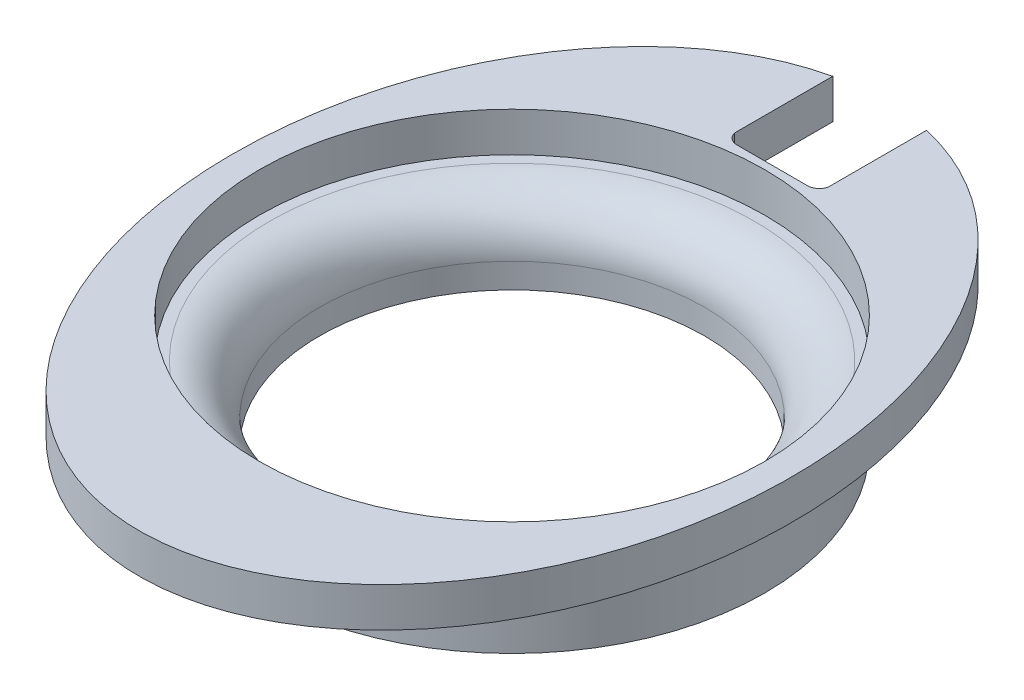
from build123d import *

# Parameters (mm, degrees)
SKETCH2_R           = 20.335
BOSS_EXTRUDE1_DEPTH = 3.175
SKETCH2_4_R         = 20.335
BOSS_EXTRUDE2_DEPTH = 6
SKETCH3_R           = 15.5
CUT_EXTRUDE1_DEPTH  = 6
FILLET2_R           = 4


with BuildPart() as part:
    # Sketch2 → Boss-Extrude1 (new body)
    with BuildSketch(Plane(origin=(0, 0, 0), x_dir=(1, 0, 0), z_dir=(0, 1, 0))):
        with BuildLine():
            Line((-3.771138016, 21.675595911), (-3.771138016, 29.575621134))
            add(Edge.make_bspline(
                [(-3.771138016, 29.575621134), (-37.647416572, 21.896496414), (-18.823708286, -16.434003035), (0, -54.764502483), (18.823708286, -16.434003035), (37.647416572, 21.896496414), (3.771138016, 29.575621134)],
                knots=[3.309993603, 3.309993603, 3.309993603, 5.292121406, 5.292121406, 7.274249208, 7.274249208, 9.256377011, 9.256377011, 9.256377011], degree=2, weights=[1, 0.547800101, 1, 0.547800101, 1, 0.547800101, 1]))
            Line((3.771138016, 29.575621134), (3.771138016, 21.675595911))
            ThreePointArc((3.771138016, 21.675595911), (3.433198339, 21.140888968), (2.835965916, 20.932494697))
            Line((2.835965916, 20.932494697), (-2.664034084, 20.932494697))
            Line((-2.664034084, 20.932494697), (-2.835965916, 20.932494697))
            ThreePointArc((-2.835965916, 20.932494697), (-3.433198339, 21.140888968), (-3.771138016, 21.675595911))
        make_face()
        Circle(SKETCH2_R, mode=Mode.SUBTRACT)
    extrude(amount=BOSS_EXTRUDE1_DEPTH)


with BuildPart() as body_2:
    # Sketch2<4> → Boss-Extrude2 (new body)
    with BuildSketch(Plane(origin=(0, 0, 0), x_dir=(1, 0, 0), z_dir=(0, 1, 0))):
        Circle(SKETCH2_4_R)
    extrude(amount=-BOSS_EXTRUDE2_DEPTH)

    # Sketch3 → Cut-Extrude1 (cut)
    with BuildSketch(Plane(origin=(0, 0, 0), x_dir=(1, 0, 0), z_dir=(0, 1, 0))):
        Circle(SKETCH3_R)
    extrude(amount=-CUT_EXTRUDE1_DEPTH, mode=Mode.SUBTRACT)

    # Fillet2
    fillet2_edges = [body_2.edges().sort_by_distance(p)[0] for p in [
        (-15.5, 0, 0),
    ]]
    fillet(fillet2_edges, radius=FILLET2_R)


solid = Compound([part.part, body_2.part])
